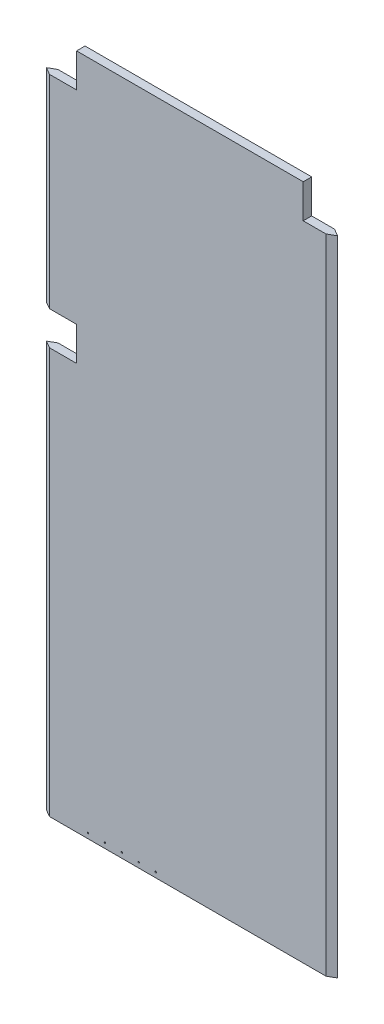
from build123d import *

# Parameters (mm, degrees)
SKETCH_1_W             = 669.944195316
SKETCH_1_H             = 25
EXTRUDE_1_DEPTH        = 2000
EXTRUDE_2_DEPTH        = 1900
EXTRUDE_3_DEPTH        = 1900
CUT_EXTRUDE_1_REACH    = 2058.168
SKETCH_5_W             = 21.650635094
SKETCH_5_H             = 100
SKETCH_5_W_2           = 80.005810729
HOLE_WIZARD_M5_2_D     = 4.2
PATTERN_LINEAR_2_COUNT = 5
PATTERN_LINEAR_2_PITCH = 50


with BuildPart() as part:
    # 草图1 → 凸台-拉伸1 (new body)
    with BuildSketch(Plane(origin=(0, 0, 0), x_dir=(1, 0, 0), z_dir=(0, 1, 0))):
        with Locations((-40.027902342, 0)):
            Rectangle(SKETCH_1_W, SKETCH_1_H)
    extrude(amount=EXTRUDE_1_DEPTH)

    # 草图2 → 凸台-拉伸2 (add)
    with BuildSketch(Plane.XZ):
        Polygon((294.944195316, 12.5), (362.411238515, 12.5), (384.061873609, 0), (362.411238515, -12.5), (294.944195316, -12.5), align=None)
    extrude(amount=-EXTRUDE_2_DEPTH)

    # 草图3 → 凸台-拉伸3 (add)
    with BuildSketch(Plane.XZ):
        Polygon((-375, 12.5), (-455.005810729, 12.5), (-476.656445823, 0), (-455.005810729, -12.5), (-375, -12.5), align=None)
    extrude(amount=-EXTRUDE_3_DEPTH)

    # 草图5 → 切除-拉伸1 (cut, up to next)
    with BuildSketch(Plane(origin=(0, 0, -12.5), x_dir=(-1, 0, 0), z_dir=(0, 0, -1)), mode=Mode.PRIVATE) as cut_extrude_1_sk1:
        with Locations((465.831128276, 1250)):
            Rectangle(SKETCH_5_W, SKETCH_5_H)
    cut_extrude_1_tool1 = extrude(cut_extrude_1_sk1.sketch, amount=-CUT_EXTRUDE_1_REACH, mode=Mode.PRIVATE) & part.part
    # 草图5 → 切除-拉伸1 (cut, up to next)
    with BuildSketch(Plane(origin=(0, 0, -12.5), x_dir=(-1, 0, 0), z_dir=(0, 0, -1)), mode=Mode.PRIVATE) as cut_extrude_1_sk2:
        with Locations((415.002905365, 1250)):
            Rectangle(SKETCH_5_W_2, SKETCH_5_H)
    cut_extrude_1_tool2 = extrude(cut_extrude_1_sk2.sketch, amount=-CUT_EXTRUDE_1_REACH, mode=Mode.PRIVATE) & part.part
    add(cut_extrude_1_tool1.solids().sort_by_distance((-465.831128, 1250, -12.5))[0], mode=Mode.SUBTRACT)
    add(cut_extrude_1_tool2.solids().sort_by_distance((-415.002905, 1250, -12.5))[0], mode=Mode.SUBTRACT)

    # M5 螺纹孔2 (through all)
    with Locations(Plane(origin=(-341.225810729, 15, 12.5), x_dir=(1, 0, 0), z_dir=(0, 0, 1))):
        with Locations((0, 0)):
            hole_wizard_m5_2 = Hole(HOLE_WIZARD_M5_2_D / 2)

    # 阵列(线性)2: M5 螺纹孔2 ×5
    with Locations(*[(i * PATTERN_LINEAR_2_PITCH, 0, 0) for i in range(1, PATTERN_LINEAR_2_COUNT)]):
        add(hole_wizard_m5_2, mode=Mode.SUBTRACT)


solid = part.part
